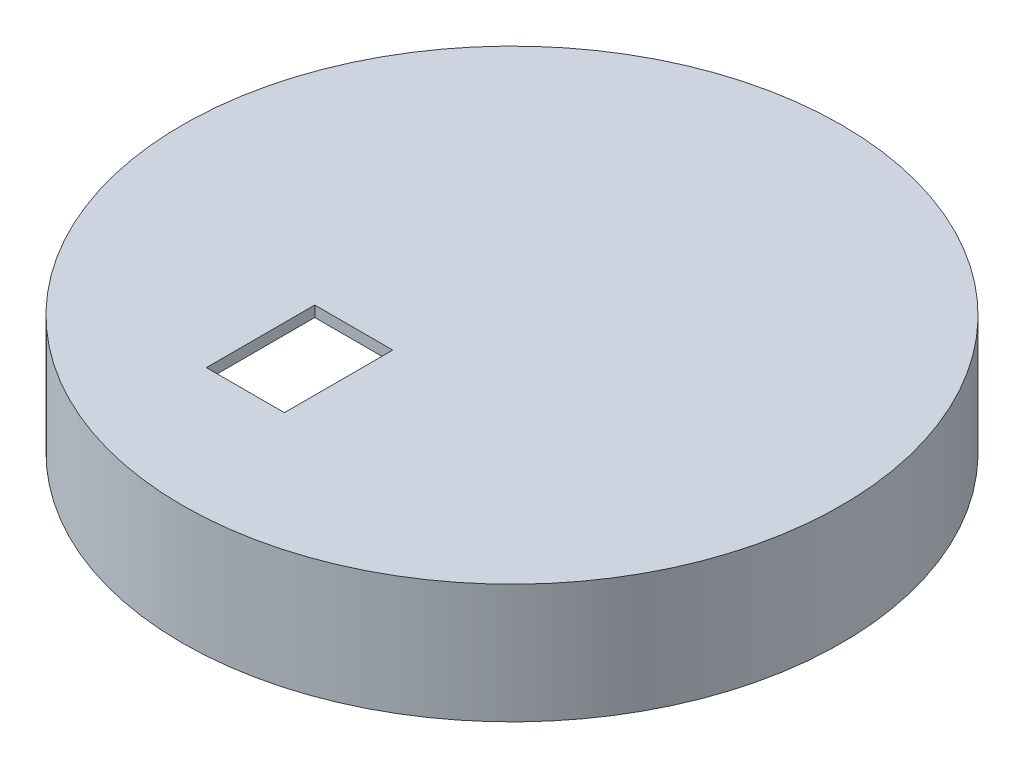
from build123d import *

# Parameters (mm, degrees)
SKIZZE1_R                       = 30.405
SKIZZE1_R_2                     = 28.405
AUFSATZ_LINEAR_AUSTRAGEN1_DEPTH = 10
SKIZZE2_R                       = 30.405
AUFSATZ_LINEAR_AUSTRAGEN2_DEPTH = 1
AUFSATZ_LINEAR_START            = 10
AUFSATZ_LINEAR_AUSTRAGEN3_DEPTH = 10
SKIZZE5_R                       = 1.5
SCHNITT_LINEAR_AUSTRAGEN2_DEPTH = 10
SKIZZE6_W                       = 7.2
SKIZZE6_H                       = 10
SCHNITT_LINEAR_AUSTRAGEN3_DEPTH = 10
KREISMUSTER1_COUNT              = 2
KREISMUSTER1_ANGLE              = 90


with BuildPart() as part:
    # Skizze1 → Aufsatz-Linear austragen1 (new body)
    with BuildSketch(Plane(origin=(0, 0, 0), x_dir=(1, 0, 0), z_dir=(0, 1, 0))):
        with Locations(Location((0, 0, 0), (0, 0, 270))):
            Circle(SKIZZE1_R)
        with Locations(Location((0, 0, 0), (0, 0, 270))):
            Circle(SKIZZE1_R_2, mode=Mode.SUBTRACT)
    extrude(amount=AUFSATZ_LINEAR_AUSTRAGEN1_DEPTH)

    # Skizze2 → Aufsatz-Linear austragen2 (add)
    with BuildSketch(Plane(origin=(0, 10, 0), x_dir=(1, 0, 0), z_dir=(0, 1, 0))):
        with Locations(Location((0, 0, 0), (0, 0, 270))):
            Circle(SKIZZE2_R)
    extrude(amount=AUFSATZ_LINEAR_AUSTRAGEN2_DEPTH)

    # Skizze4 → Aufsatz-Linear austragen3 (add)
    with BuildSketch(Plane.XZ.offset(-10).offset(AUFSATZ_LINEAR_START)):
        with BuildLine():
            ThreePointArc((-28.126789531, -3.965820935), (-23.605, 0), (-28.126789531, 3.965820935))
            ThreePointArc((-28.126789531, 3.965820935), (-28.405, 0), (-28.126789531, -3.965820935))
        make_face()
        with BuildLine():
            ThreePointArc((28.405, 0), (28.33536202, 1.987783738), (28.126789531, 3.965820935))
            ThreePointArc((28.126789531, 3.965820935), (23.605, 0), (28.126789531, -3.965820935))
            ThreePointArc((28.126789531, -3.965820935), (28.33536202, -1.987783738), (28.405, 0))
        make_face()
    aufsatz_linear_austragen3 = extrude(amount=-AUFSATZ_LINEAR_AUSTRAGEN3_DEPTH)

    # Skizze5 → Schnitt-Linear austragen2 (cut)
    with BuildSketch(Plane.XZ):
        with Locations(Location((-27.605, 0, 0), (0, 0, 270))):
            Circle(SKIZZE5_R)
        with BuildLine():
            ThreePointArc((29.105, 0), (27.605, 1.5), (26.105, 0))
            Line((26.105, 0), (29.105, 0))
        make_face()
        with BuildLine():
            Line((29.105, 0), (26.105, 0))
            ThreePointArc((26.105, 0), (27.605, -1.5), (29.105, 0))
        make_face()
    schnitt_linear_austragen2 = extrude(amount=-SCHNITT_LINEAR_AUSTRAGEN2_DEPTH, mode=Mode.SUBTRACT)

    # Skizze6 → Schnitt-Linear austragen3 (cut)
    with BuildSketch(Plane(origin=(0, 11, 0), x_dir=(1, 0, 0), z_dir=(0, 1, 0))):
        with Locations((-6.308057451, -13.288570201)):
            Rectangle(SKIZZE6_W, SKIZZE6_H)
    extrude(amount=-SCHNITT_LINEAR_AUSTRAGEN3_DEPTH, mode=Mode.SUBTRACT)

    # Kreismuster1: Aufsatz-Linear austragen3, Schnitt-Linear austragen2 ×2 about axis
    kreismuster1_axis = Axis((0, 0, 0), (0, 1, 0))
    add([aufsatz_linear_austragen3.rotate(kreismuster1_axis, i * KREISMUSTER1_ANGLE / (KREISMUSTER1_COUNT - 1)) for i in range(1, KREISMUSTER1_COUNT)])
    add([schnitt_linear_austragen2.rotate(kreismuster1_axis, i * KREISMUSTER1_ANGLE / (KREISMUSTER1_COUNT - 1)) for i in range(1, KREISMUSTER1_COUNT)], mode=Mode.SUBTRACT)


solid = part.part
